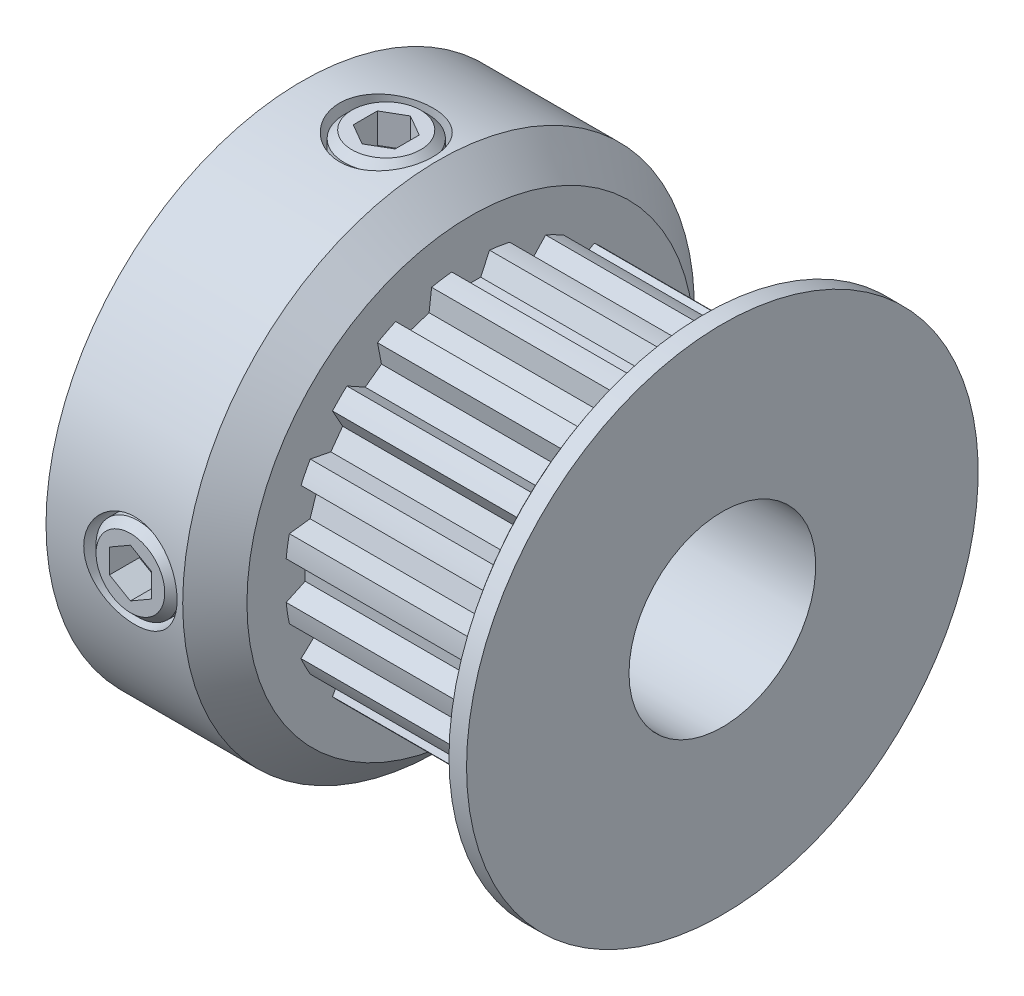
from build123d import *

# Parameters (mm, degrees)
SKETCH4_R          = 6.4643
SKETCH4_R_2        = 6.30555
CUT_EXTRUDE2_DEPTH = 7.366
CUT_EXTRUDE1_DEPTH = 7.366
CIRPATTERN1_COUNT  = 20
SKETCH6_R          = 1.5875
CUT_EXTRUDE3_DEPTH = 15.229776193
CUT_EXTRUDE4_DEPTH = 1.016
CIRPATTERN2_COUNT  = 2
CIRPATTERN2_ANGLE  = 90
CIRPATTERN3_COUNT  = 2
CIRPATTERN3_ANGLE  = 90


with BuildPart() as part:
    # Sketch1 → Revolve1 (revolve)
    with BuildSketch(Plane.XY, mode=Mode.PRIVATE) as revolve1_sk:
        with BuildLine():
            Line((-7.1501, 3.175), (7.1501, 3.175))
            Line((7.1501, 3.175), (7.1501, 8.6995))
            Line((7.1501, 8.6995), (6.5532, 8.6995))
            ThreePointArc((6.5532, 8.6995), (6.110040889, 7.919568536), (5.9563, 7.0358))
            Line((5.9563, 7.0358), (5.9563, 6.4643))
            Line((5.9563, 6.4643), (-1.4097, 6.4643))
            Line((-1.4097, 6.4643), (-1.4097, 7.6073))
            Line((-1.4097, 7.6073), (-2.5019, 8.6995))
            Line((-2.5019, 8.6995), (-7.1501, 8.6995))
            Line((-7.1501, 8.6995), (-7.1501, 3.175))
        make_face()
    revolve(revolve1_sk.sketch.rotate(Axis((-7.1501, 0, 0), (1, 0, 0)), 90), axis=Axis((-7.1501, 0, 0), (1, 0, 0)))

    # Sketch4 → Cut-Extrude2 (cut)
    with BuildSketch(Plane(origin=(-1.4097, 0, 0), x_dir=(0, 0, -1), z_dir=(1, 0, 0))):
        Circle(SKETCH4_R)
        Circle(SKETCH4_R_2, mode=Mode.SUBTRACT)
    extrude(amount=CUT_EXTRUDE2_DEPTH, mode=Mode.SUBTRACT)

    # Sketch3 → Cut-Extrude1 (cut)
    with BuildSketch(Plane(origin=(-1.4097, 0, 0), x_dir=(0, 0, -1), z_dir=(1, 0, 0))):
        with BuildLine():
            Line((-0.642631898, 6.272717517), (-0.342185353, 5.628407823))
            Line((-0.342185353, 5.628407823), (0.342185353, 5.628407823))
            Line((0.342185353, 5.628407823), (0.642631898, 6.272717517))
            ThreePointArc((0.642631898, 6.272717517), (0, 6.30555), (-0.642631898, 6.272717517))
        make_face()
    cut_extrude1 = extrude(amount=CUT_EXTRUDE1_DEPTH, mode=Mode.SUBTRACT)

    # CirPattern1: Cut-Extrude1 ×20 about axis
    cirpattern1_axis = Axis((0, 0, 0), (1, 0, 0))
    for i in range(1, CIRPATTERN1_COUNT):
        add(cut_extrude1.rotate(cirpattern1_axis, i * 360 / CIRPATTERN1_COUNT), mode=Mode.SUBTRACT)

    # Sketch6 → Cut-Extrude3 (cut, through all)
    with BuildSketch(Plane(origin=(0, 0, 0), x_dir=(1, 0, 0), z_dir=(0, 1, 0))):
        with Locations(Location((-4.2799, 0, 0), (0, 0, 90))):
            Circle(SKETCH6_R)
    cut_extrude3 = extrude(amount=CUT_EXTRUDE3_DEPTH, mode=Mode.SUBTRACT)

    # CirPattern2: Cut-Extrude3 ×2 about axis
    cirpattern2_axis = Axis((-7.1501, 0, 0), (1, 0, 0))
    for i in range(1, CIRPATTERN2_COUNT):
        add(cut_extrude3.rotate(cirpattern2_axis, i * CIRPATTERN2_ANGLE / (CIRPATTERN2_COUNT - 1)), mode=Mode.SUBTRACT)


with BuildPart() as body_2:
    # Sketch7 → Revolve2 (revolve)
    with BuildSketch(Plane.XY, mode=Mode.PRIVATE) as revolve2_sk:
        Polygon((-5.4483, 8.6995), (-4.2799, 8.6995), (-4.2799, 3.556), (-5.4483, 3.556), (-5.7023, 3.81), (-5.7023, 8.4455), align=None)
    revolve(revolve2_sk.sketch.rotate(Axis((-4.2799, 3.556, 0), (0, 1, 0)), 270), axis=Axis((-4.2799, 3.556, 0), (0, 1, 0)))

    # Sketch8 → Cut-Extrude4 (cut)
    with BuildSketch(Plane(origin=(0, 8.6995, 0), x_dir=(1, 0, 0), z_dir=(0, 1, 0))):
        Polygon((-4.2799, 0.821223023), (-4.9911, 0.410611511), (-4.9911, -0.410611511), (-4.2799, -0.821223023), (-3.5687, -0.410611511), (-3.5687, 0.410611511), align=None)
    extrude(amount=-CUT_EXTRUDE4_DEPTH, mode=Mode.SUBTRACT)


with BuildPart() as cirpattern3_1:
    # CirPattern3: pattern copy
    add(body_2.part.rotate(Axis((0, 0, 0), (1, 0, 0)), 1 * CIRPATTERN3_ANGLE / (CIRPATTERN3_COUNT - 1)))


solid = Compound([part.part, body_2.part, cirpattern3_1.part])
